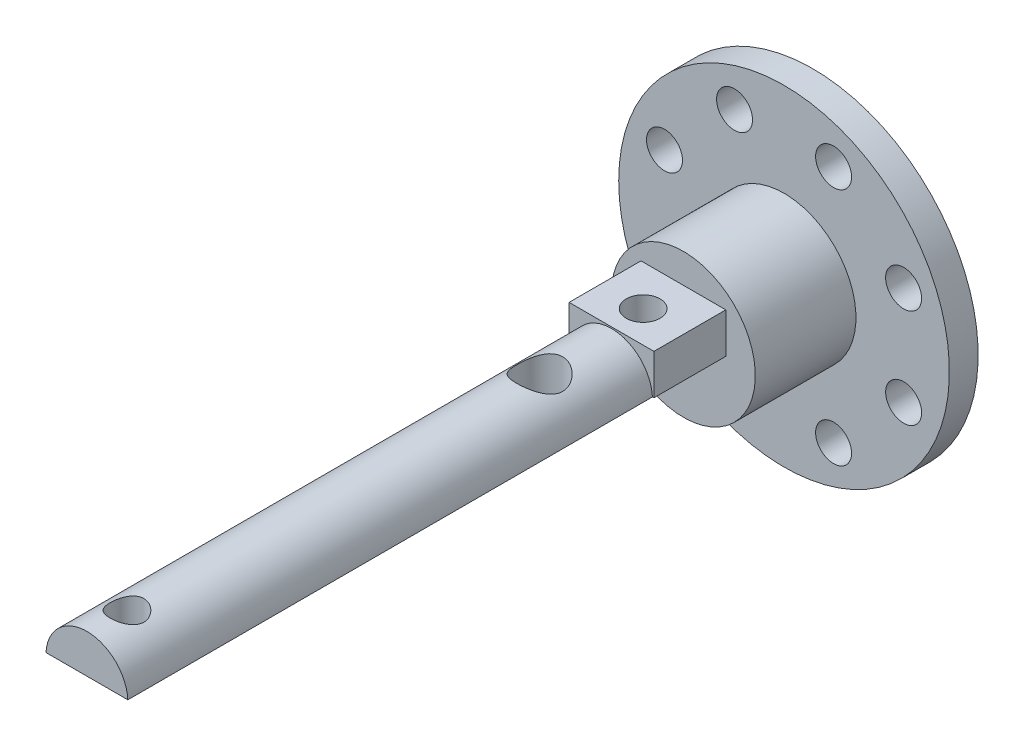
from build123d import *

# Parameters (mm, degrees)
SKETCH_1_R           = 2.85
EXTRUDE_1_DEPTH      = 31.5
SKETCH_3_W           = 5.9
SKETCH_3_H           = 5.9
EXTRUDE_2_DEPTH      = 5
SKETCH_4_R           = 5
EXTRUDE_3_DEPTH      = 7
SKETCH_6_R           = 11.5
EXTRUDE_4_DEPTH      = 2
SKETCH_8_R           = 4.5
CUT_EXTRUDE_2_DEPTH  = 7.5
SKETCH_9_R           = 1.25
CUT_EXTRUDE_3_DEPTH  = 5.5
SKETCH_10_R          = 1.175
CUT_EXTRUDE_7_DEPTH  = 10
SKETCH_12_W          = 5.9
SKETCH_12_H          = 5.9
EXTRUDE_5_DEPTH      = 45
SKETCH_15_W          = 5.9
SKETCH_15_H          = 20.04910328
EXTRUDE_6_DEPTH      = 6
SKETCH_16_R          = 1.175
CUT_EXTRUDE_8_DEPTH  = 10
SKETCH_18_W          = 41.5
SKETCH_18_H          = 3.1
CUT_EXTRUDE_9_DEPTH  = 10
SKETCH_19_W          = 46.016613228
SKETCH_19_H          = 26.924390235
CUT_EXTRUDE_10_DEPTH = 10
SKETCH_21_OUTSIDE_W  = 37.01
SKETCH_21_OUTSIDE_H  = 37.01
SKETCH_21_OUTSIDE_R  = 2.85
CUT_EXTRUDE_11_DEPTH = 10
SKETCH_22_R          = 1.6
CUT_EXTRUDE_12_DEPTH = 3


with BuildPart() as part:
    # 스케치1 → 보스-돌출1 (new body)
    with BuildSketch(Plane.XY):
        Circle(SKETCH_1_R)
    extrude(amount=EXTRUDE_1_DEPTH)

    # 스케치3 → 보스-돌출2 (add)
    with BuildSketch(Plane(origin=(0, 0, 0), x_dir=(-1, 0, 0), z_dir=(0, 0, -1))):
        Rectangle(SKETCH_3_W, SKETCH_3_H)
    extrude(amount=EXTRUDE_2_DEPTH)

    # 스케치4 → 보스-돌출3 (add)
    with BuildSketch(Plane(origin=(0, 0, -5), x_dir=(-1, 0, 0), z_dir=(0, 0, -1))):
        Circle(SKETCH_4_R)
    extrude(amount=EXTRUDE_3_DEPTH)

    # 스케치6 → 보스-돌출4 (add)
    with BuildSketch(Plane(origin=(0, 0, -12), x_dir=(-1, 0, 0), z_dir=(0, 0, -1))):
        Circle(SKETCH_6_R)
    extrude(amount=EXTRUDE_4_DEPTH)

    # 스케치8 → 컷-돌출2 (cut)
    with BuildSketch(Plane(origin=(0, 0, -14), x_dir=(-1, 0, 0), z_dir=(0, 0, -1))):
        Circle(SKETCH_8_R)
    extrude(amount=-CUT_EXTRUDE_2_DEPTH, mode=Mode.SUBTRACT)

    # 스케치9 → 컷-돌출3 (cut)
    with BuildSketch(Plane(origin=(0, 0, -14), x_dir=(-1, 0, 0), z_dir=(0, 0, -1))):
        with Locations((3.444150891, 8.314915793)):
            Circle(SKETCH_9_R)
        with Locations((-3.444150891, 8.314915793)):
            Circle(SKETCH_9_R)
        with Locations((8.314915793, 3.444150891)):
            Circle(SKETCH_9_R)
        with Locations((8.314915793, -3.444150891)):
            Circle(SKETCH_9_R)
        with Locations((3.444150891, -8.314915793)):
            Circle(SKETCH_9_R)
        with Locations((-3.444150891, -8.314915793)):
            Circle(SKETCH_9_R)
        with Locations((-8.314915793, -3.444150891)):
            Circle(SKETCH_9_R)
        with Locations((-8.314915793, 3.444150891)):
            Circle(SKETCH_9_R)
    extrude(amount=-CUT_EXTRUDE_3_DEPTH, mode=Mode.SUBTRACT)

    # 스케치10 → 컷-돌출7 (cut)
    with BuildSketch(Plane(origin=(0, 2.95, 0), x_dir=(1, 0, 0), z_dir=(0, 1, 0))):
        with Locations(Location((0, 2.2, 0), (0, 0, 180))):
            Circle(SKETCH_10_R)
    extrude(amount=-CUT_EXTRUDE_7_DEPTH, mode=Mode.SUBTRACT)

    # 스케치12 → 보스-돌출5 (add)
    with BuildSketch(Plane.XY.offset(31.5)):
        Rectangle(SKETCH_12_W, SKETCH_12_H)
    extrude(amount=EXTRUDE_5_DEPTH)

    # 스케치15 → 보스-돌출6 (add)
    with BuildSketch(Plane.XY.offset(76.5)):
        Rectangle(SKETCH_15_W, SKETCH_15_H)
    extrude(amount=EXTRUDE_6_DEPTH)

    # 스케치16 → 컷-돌출8 (cut)
    with BuildSketch(Plane(origin=(0, 2.95, 0), x_dir=(1, 0, 0), z_dir=(0, 1, 0))):
        with Locations(Location((0, -33.7, 0), (0, 0, 270))):
            Circle(SKETCH_16_R)
    extrude(amount=-CUT_EXTRUDE_8_DEPTH, mode=Mode.SUBTRACT)

    # 스케치18 → 컷-돌출9 (cut)
    with BuildSketch(Plane(origin=(2.95, 0, 0), x_dir=(0, 0, -1), z_dir=(1, 0, 0))):
        with Locations((-15.75, -1.4)):
            Rectangle(SKETCH_18_W, SKETCH_18_H)
    extrude(amount=-CUT_EXTRUDE_9_DEPTH, mode=Mode.SUBTRACT)

    # 스케치19 → 컷-돌출10 (cut)
    with BuildSketch(Plane(origin=(2.95, 0, 0), x_dir=(0, 0, -1), z_dir=(1, 0, 0))):
        with Locations((-59.491693386, -3.437643478)):
            Rectangle(SKETCH_19_W, SKETCH_19_H)
    extrude(amount=-CUT_EXTRUDE_10_DEPTH, mode=Mode.SUBTRACT)

    # 스케치21 outside → 컷-돌출11 (cut)
    with BuildSketch(Plane.XY.offset(36.483386772)):
        Rectangle(SKETCH_21_OUTSIDE_W, SKETCH_21_OUTSIDE_H)
        Circle(SKETCH_21_OUTSIDE_R, mode=Mode.SUBTRACT)
    extrude(amount=-CUT_EXTRUDE_11_DEPTH, mode=Mode.SUBTRACT)

    # 스케치22 → 컷-돌출12 (cut)
    with BuildSketch(Plane(origin=(0, 2.95, 0), x_dir=(1, 0, 0), z_dir=(0, 1, 0))):
        with Locations(Location((0, -5, 0), (0, 0, 180))):
            Circle(SKETCH_22_R)
    extrude(amount=-CUT_EXTRUDE_12_DEPTH, mode=Mode.SUBTRACT)


solid = part.part
